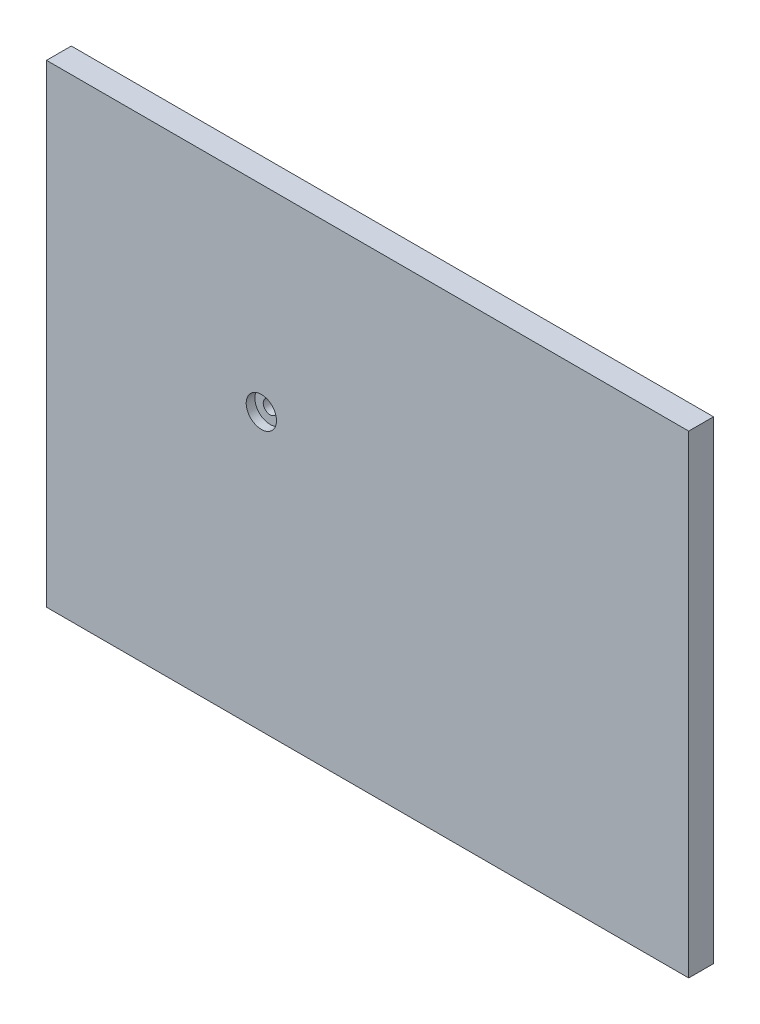
from build123d import *

# Parameters (mm, degrees)
SKETCH1_W                               = 259.091032746
SKETCH1_H                               = 191.090198632
BOSS_EXTRUDE1_DEPTH                     = 10
CBORE_FOR_M5_HEX_HEAD_BOLT1_D           = 5.5
CBORE_FOR_M5_HEX_HEAD_BOLT1_CBORE_D     = 12.238
CBORE_FOR_M5_HEX_HEAD_BOLT1_CBORE_DEPTH = 3.5


with BuildPart() as part:
    # Sketch1 → Boss-Extrude1 (new body)
    with BuildSketch(Plane.XY):
        Rectangle(SKETCH1_W, SKETCH1_H)
    extrude(amount=BOSS_EXTRUDE1_DEPTH)

    # CBORE for M5 Hex Head Bolt1 (through all)
    with Locations(Plane.XY.offset(10)):
        with Locations((-42.860954057, 16.035039283)):
            CounterBoreHole(CBORE_FOR_M5_HEX_HEAD_BOLT1_D / 2, CBORE_FOR_M5_HEX_HEAD_BOLT1_CBORE_D / 2, CBORE_FOR_M5_HEX_HEAD_BOLT1_CBORE_DEPTH)


solid = part.part
